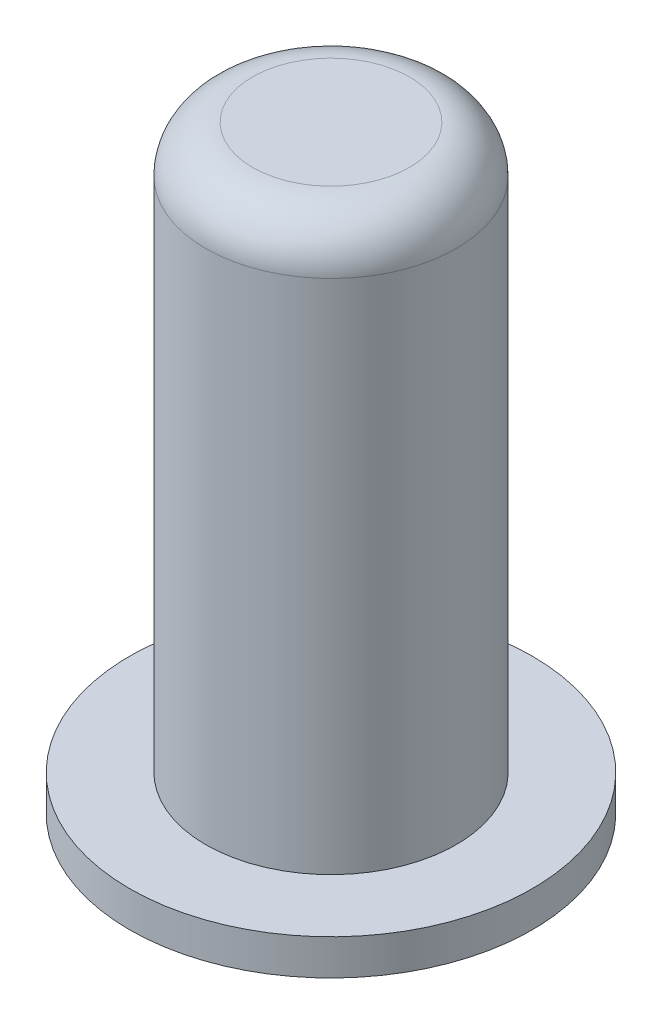
from build123d import *

# Parameters (mm, degrees)
SKETCH2_R           = 5.4356
BOSS_EXTRUDE1_DEPTH = 24.4348
SKETCH3_R           = 8.7376
BOSS_EXTRUDE2_DEPTH = 1.5494
FILLET1_R           = 2.032


with BuildPart() as part:
    # Sketch2 → Boss-Extrude1 (new body)
    with BuildSketch(Plane(origin=(0, 0, 0), x_dir=(1, 0, 0), z_dir=(0, 1, 0))):
        with Locations(Location((0, 0, 0), (0, 0, 270))):
            Circle(SKETCH2_R)
    extrude(amount=BOSS_EXTRUDE1_DEPTH)

    # Sketch3 → Boss-Extrude2 (add)
    with BuildSketch(Plane.XZ):
        with Locations(Location((0, 0, 0), (0, 0, 270))):
            Circle(SKETCH3_R)
    extrude(amount=BOSS_EXTRUDE2_DEPTH)

    # Fillet1
    fillet1_edges = [part.edges().sort_by_distance(p)[0] for p in [
        (0, 24.4348, -5.4356),
    ]]
    fillet(fillet1_edges, radius=FILLET1_R)


solid = part.part
